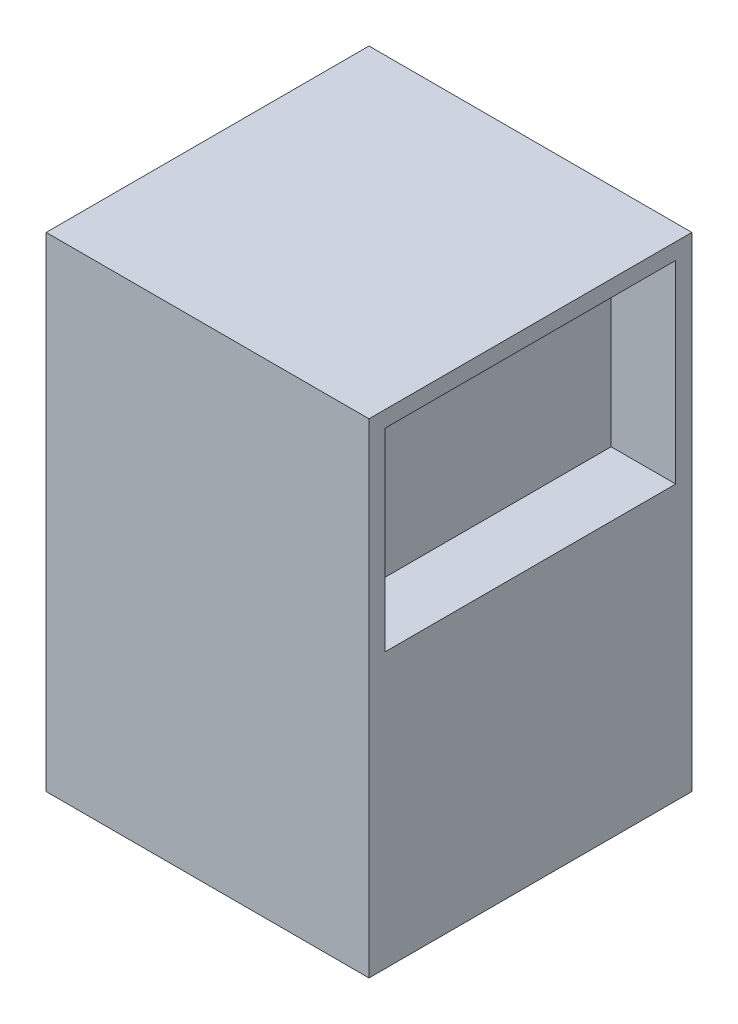
from build123d import *

# Parameters (mm, degrees)
BOSS_EXTRUDE1_DEPTH      = 5
BOSS_EXTRUDE1_DEPTH_BACK = 5
SKETCH1_W                = 10
SKETCH1_H                = 15
SKETCH3_W                = 9
SKETCH3_H                = 6
CUT_EXTRUDE2_DEPTH       = 2


with BuildPart() as part:
    # Sketch1 → Boss-Extrude1 (new, two sides: drawn at the far end of the back side and taken through both)
    with BuildSketch(Plane.XY.offset(-BOSS_EXTRUDE1_DEPTH_BACK)):
        with Locations((0, 1.32209169)):
            Rectangle(SKETCH1_W, SKETCH1_H)
    extrude(amount=BOSS_EXTRUDE1_DEPTH + BOSS_EXTRUDE1_DEPTH_BACK)

    # Sketch3 → Cut-Extrude2 (cut)
    with BuildSketch(Plane(origin=(5, 0, 0), x_dir=(0, 0, -1), z_dir=(1, 0, 0))):
        with Locations((0, 5.32209169)):
            Rectangle(SKETCH3_W, SKETCH3_H)
    extrude(amount=-CUT_EXTRUDE2_DEPTH, mode=Mode.SUBTRACT)


solid = part.part
